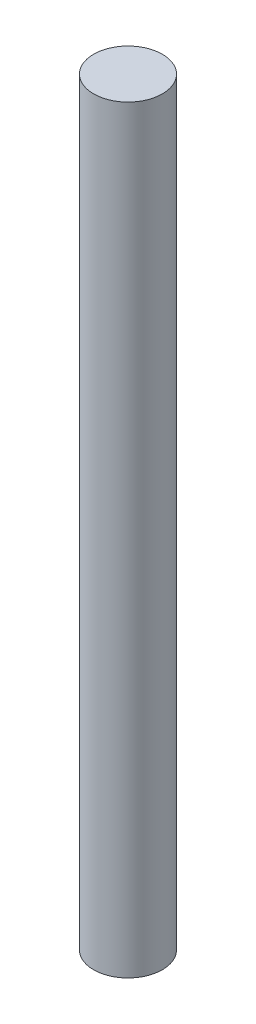
from build123d import *

# Parameters (mm, degrees)
SKETCH1_R           = 6.477
BOSS_EXTRUDE1_DEPTH = 143.002


with BuildPart() as part:
    # Sketch1 → Boss-Extrude1 (new body)
    with BuildSketch(Plane(origin=(0, 0, 0), x_dir=(1, 0, 0), z_dir=(0, 1, 0))):
        with Locations(Location((0, 0, 0), (0, 0, 270))):
            Circle(SKETCH1_R)
    extrude(amount=BOSS_EXTRUDE1_DEPTH)


solid = part.part
